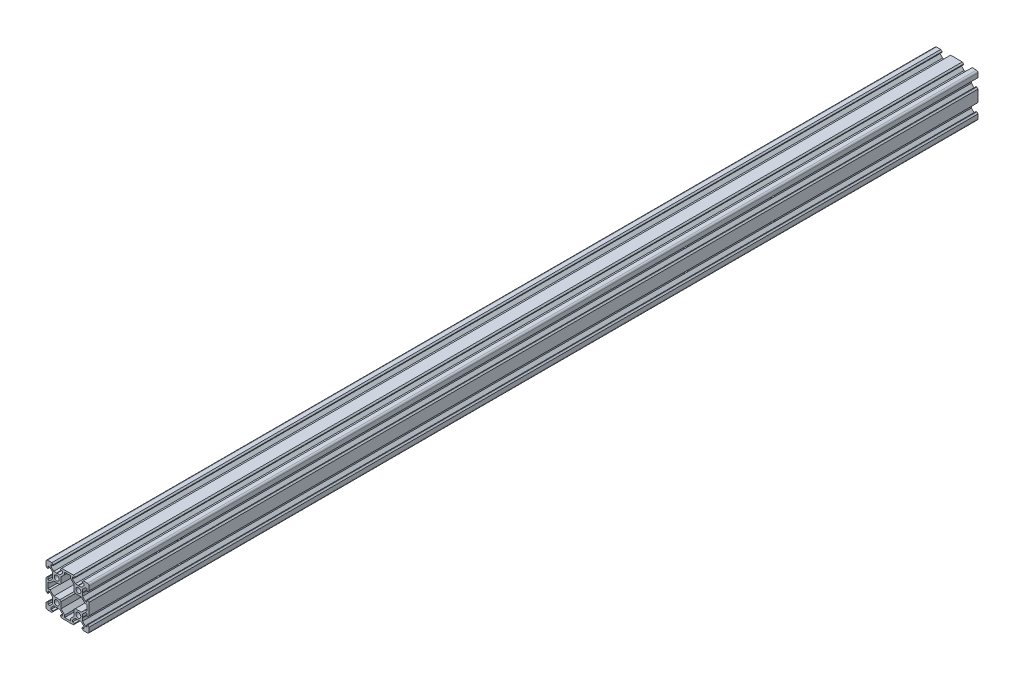
from build123d import *

# Parameters (mm, degrees)
SKETCH1_R            = 2.3
BOSS_EXTRUDE1_DEPTH  = 825
M5_CLEARANCE_HOLE1_D = 5.5


with BuildPart() as part:
    # Sketch1 → Boss-Extrude1 (new body)
    with BuildSketch(Plane.XY):
        with BuildLine():
            Line((14.58, -20), (18.5, -20))
            ThreePointArc((18.5, -20), (19.560660172, -19.560660172), (20, -18.5))
            Line((20, -18.5), (20, -14.58))
            Line((20, -14.58), (18.815, -13.395))
            Line((18.815, -13.395), (18.2, -13.395))
            Line((18.2, -13.395), (18.2, -15.5))
            Line((18.2, -15.5), (16.560660172, -15.5))
            Line((16.560660172, -15.5), (13.9, -12.839339828))
            Line((13.9, -12.839339828), (13.9, -10.21))
            Line((13.9, -10.21), (13.69, -10))
            Line((13.69, -10), (13.9, -9.79))
            Line((13.9, -9.79), (13.9, -7.160660172))
            Line((13.9, -7.160660172), (16.560660172, -4.5))
            Line((16.560660172, -4.5), (18.2, -4.5))
            Line((18.2, -4.5), (18.2, -6.605))
            Line((18.2, -6.605), (18.815, -6.605))
            Line((18.815, -6.605), (20, -5.42))
            Line((20, -5.42), (20, 5.42))
            Line((20, 5.42), (18.815, 6.605))
            Line((18.815, 6.605), (18.2, 6.605))
            Line((18.2, 6.605), (18.2, 4.5))
            Line((18.2, 4.5), (16.560660172, 4.5))
            Line((16.560660172, 4.5), (13.9, 7.160660172))
            Line((13.9, 7.160660172), (13.9, 9.79))
            Line((13.9, 9.79), (13.69, 10))
            Line((13.69, 10), (13.9, 10.21))
            Line((13.9, 10.21), (13.9, 12.839339828))
            Line((13.9, 12.839339828), (16.560660172, 15.5))
            Line((16.560660172, 15.5), (18.2, 15.5))
            Line((18.2, 15.5), (18.2, 13.395))
            Line((18.2, 13.395), (18.815, 13.395))
            Line((18.815, 13.395), (20, 14.58))
            Line((20, 14.58), (20, 18.5))
            ThreePointArc((20, 18.5), (19.560660172, 19.560660172), (18.5, 20))
            Line((18.5, 20), (14.58, 20))
            Line((14.58, 20), (13.395, 18.815))
            Line((13.395, 18.815), (13.395, 18.2))
            Line((13.395, 18.2), (15.5, 18.2))
            Line((15.5, 18.2), (15.5, 16.560660172))
            Line((15.5, 16.560660172), (12.839339828, 13.9))
            Line((12.839339828, 13.9), (10.21, 13.9))
            Line((10.21, 13.9), (10, 13.69))
            Line((10, 13.69), (9.79, 13.9))
            Line((9.79, 13.9), (7.160660172, 13.9))
            Line((7.160660172, 13.9), (4.5, 16.560660172))
            Line((4.5, 16.560660172), (4.5, 18.2))
            Line((4.5, 18.2), (6.605, 18.2))
            Line((6.605, 18.2), (6.605, 18.815))
            Line((6.605, 18.815), (5.42, 20))
            Line((5.42, 20), (-5.42, 20))
            Line((-5.42, 20), (-6.605, 18.815))
            Line((-6.605, 18.815), (-6.605, 18.2))
            Line((-6.605, 18.2), (-4.5, 18.2))
            Line((-4.5, 18.2), (-4.5, 16.560660172))
            Line((-4.5, 16.560660172), (-7.160660172, 13.9))
            Line((-7.160660172, 13.9), (-9.79, 13.9))
            Line((-9.79, 13.9), (-10, 13.69))
            Line((-10, 13.69), (-10.21, 13.9))
            Line((-10.21, 13.9), (-12.839339828, 13.9))
            Line((-12.839339828, 13.9), (-15.5, 16.560660172))
            Line((-15.5, 16.560660172), (-15.5, 18.2))
            Line((-15.5, 18.2), (-13.395, 18.2))
            Line((-13.395, 18.2), (-13.395, 18.815))
            Line((-13.395, 18.815), (-14.58, 20))
            Line((-14.58, 20), (-18.5, 20))
            ThreePointArc((-18.5, 20), (-19.560660172, 19.560660172), (-20, 18.5))
            Line((-20, 18.5), (-20, 14.58))
            Line((-20, 14.58), (-18.815, 13.395))
            Line((-18.815, 13.395), (-18.2, 13.395))
            Line((-18.2, 13.395), (-18.2, 15.5))
            Line((-18.2, 15.5), (-16.560660172, 15.5))
            Line((-16.560660172, 15.5), (-13.9, 12.839339828))
            Line((-13.9, 12.839339828), (-13.9, 10.21))
            Line((-13.9, 10.21), (-13.69, 10))
            Line((-13.69, 10), (-13.9, 9.79))
            Line((-13.9, 9.79), (-13.9, 7.160660172))
            Line((-13.9, 7.160660172), (-16.560660172, 4.5))
            Line((-16.560660172, 4.5), (-18.2, 4.5))
            Line((-18.2, 4.5), (-18.2, 6.605))
            Line((-18.2, 6.605), (-18.815, 6.605))
            Line((-18.815, 6.605), (-20, 5.42))
            Line((-20, 5.42), (-20, -5.42))
            Line((-20, -5.42), (-18.815, -6.605))
            Line((-18.815, -6.605), (-18.2, -6.605))
            Line((-18.2, -6.605), (-18.2, -4.5))
            Line((-18.2, -4.5), (-16.560660172, -4.5))
            Line((-16.560660172, -4.5), (-13.9, -7.160660172))
            Line((-13.9, -7.160660172), (-13.9, -9.79))
            Line((-13.9, -9.79), (-13.69, -10))
            Line((-13.69, -10), (-13.9, -10.21))
            Line((-13.9, -10.21), (-13.9, -12.839339828))
            Line((-13.9, -12.839339828), (-16.560660172, -15.5))
            Line((-16.560660172, -15.5), (-18.2, -15.5))
            Line((-18.2, -15.5), (-18.2, -13.395))
            Line((-18.2, -13.395), (-18.815, -13.395))
            Line((-18.815, -13.395), (-20, -14.58))
            Line((-20, -14.58), (-20, -18.5))
            ThreePointArc((-20, -18.5), (-19.560660172, -19.560660172), (-18.5, -20))
            Line((-18.5, -20), (-14.58, -20))
            Line((-14.58, -20), (-13.395, -18.815))
            Line((-13.395, -18.815), (-13.395, -18.2))
            Line((-13.395, -18.2), (-15.5, -18.2))
            Line((-15.5, -18.2), (-15.5, -16.560660172))
            Line((-15.5, -16.560660172), (-12.839339828, -13.9))
            Line((-12.839339828, -13.9), (-10.21, -13.9))
            Line((-10.21, -13.9), (-10, -13.69))
            Line((-10, -13.69), (-9.79, -13.9))
            Line((-9.79, -13.9), (-7.160660172, -13.9))
            Line((-7.160660172, -13.9), (-4.5, -16.560660172))
            Line((-4.5, -16.560660172), (-4.5, -18.2))
            Line((-4.5, -18.2), (-6.605, -18.2))
            Line((-6.605, -18.2), (-6.605, -18.815))
            Line((-6.605, -18.815), (-5.42, -20))
            Line((-5.42, -20), (5.42, -20))
            Line((5.42, -20), (6.605, -18.815))
            Line((6.605, -18.815), (6.605, -18.2))
            Line((6.605, -18.2), (4.5, -18.2))
            Line((4.5, -18.2), (4.5, -16.560660172))
            Line((4.5, -16.560660172), (7.160660172, -13.9))
            Line((7.160660172, -13.9), (9.79, -13.9))
            Line((9.79, -13.9), (10, -13.69))
            Line((10, -13.69), (10.21, -13.9))
            Line((10.21, -13.9), (12.839339828, -13.9))
            Line((12.839339828, -13.9), (15.5, -16.560660172))
            Line((15.5, -16.560660172), (15.5, -18.2))
            Line((15.5, -18.2), (13.395, -18.2))
            Line((13.395, -18.2), (13.395, -18.815))
            Line((13.395, -18.815), (14.58, -20))
        make_face()
        with Locations((-10, -10)):
            Circle(SKETCH1_R, mode=Mode.SUBTRACT)
        with Locations((10, -10)):
            Circle(SKETCH1_R, mode=Mode.SUBTRACT)
        Polygon((-16.239339828, -2.7), (-18.2, -2.7), (-18.2, 2.7), (-16.239339828, 2.7), (-12.839339828, 6.1), (-7.160660172, 6.1), (-6.1, 7.160660172), (-6.1, 12.839339828), (-2.7, 16.239339828), (-2.7, 18.2), (2.7, 18.2), (2.7, 16.239339828), (6.1, 12.839339828), (6.1, 7.160660172), (7.160660172, 6.1), (12.839339828, 6.1), (16.239339828, 2.7), (18.2, 2.7), (18.2, -2.7), (16.239339828, -2.7), (12.839339828, -6.1), (7.160660172, -6.1), (6.1, -7.160660172), (6.1, -12.839339828), (2.7, -16.239339828), (2.7, -18.2), (-2.7, -18.2), (-2.7, -16.239339828), (-6.1, -12.839339828), (-6.1, -7.160660172), (-7.160660172, -6.1), (-12.839339828, -6.1), align=None, mode=Mode.SUBTRACT)
        with Locations((-10, 10)):
            Circle(SKETCH1_R, mode=Mode.SUBTRACT)
        with Locations((10, 10)):
            Circle(SKETCH1_R, mode=Mode.SUBTRACT)
    extrude(amount=BOSS_EXTRUDE1_DEPTH)

    # M5 Clearance Hole1 (through all)
    with Locations(Plane(origin=(20, 10, 755), x_dir=(0, 0, 1), z_dir=(1, 0, 0))):
        with Locations((0, 0), (0, 20), (-20, 20), (-20, 0), (-490, 0), (-490, 20), (-570.5, 0), (-570.5, 20)):
            Hole(M5_CLEARANCE_HOLE1_D / 2)


solid = part.part
